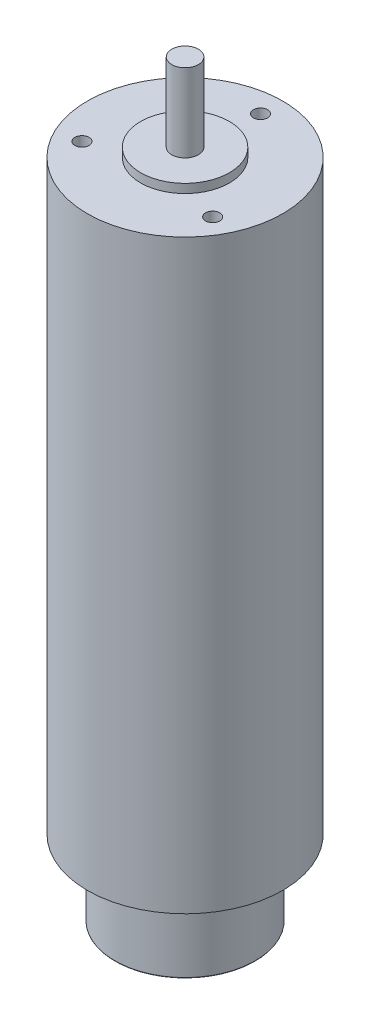
from build123d import *

# Parameters (mm, degrees)
SKETCH_1_R               = 11
EXTRUDE_1_DEPTH          = 66
SKETCH_2_R               = 5
EXTRUDE_2_DEPTH          = 1
SKETCH_3_R               = 1.5
EXTRUDE_3_DEPTH          = 8.8
SKETCH_4_R               = 7.9
EXTRUDE_4_DEPTH          = 8.5
FILLET_2_R               = 0.1
PATTERN_CIRCULAR_2_COUNT = 3


with BuildPart() as part:
    # 스케치1 → 보스-돌출1 (new body)
    with BuildSketch(Plane(origin=(0, 0, 0), x_dir=(1, 0, 0), z_dir=(0, 1, 0))):
        with Locations(Location((0, 0, 0), (0, 0, 270))):
            Circle(SKETCH_1_R)
    extrude(amount=EXTRUDE_1_DEPTH)

    # 스케치8 → M2 나사 구멍1 (revolve, cut)
    with BuildSketch(Plane(origin=(0, 66, -8.5), x_dir=(0, 0, 1), z_dir=(1, 0, 0))):
        Polygon((0, 0), (0, 5.480688495), (0.8, 5), (0.8, 0), align=None)
    hole_wizard_m2_1 = revolve(axis=Axis((0, 72.35, -8.5), (0, -1, 0)), mode=Mode.SUBTRACT)

    # 원형 패턴2: M2 나사 구멍1 ×3 about axis
    pattern_circular_2_axis = Axis((0, 0, 0), (0, 1, 0))
    for i in range(1, PATTERN_CIRCULAR_2_COUNT):
        add(hole_wizard_m2_1.rotate(pattern_circular_2_axis, i * 360 / PATTERN_CIRCULAR_2_COUNT), mode=Mode.SUBTRACT)


with BuildPart() as body_2:
    # 스케치2 → 보스-돌출2 (new body)
    with BuildSketch(Plane(origin=(0, 66, 0), x_dir=(1, 0, 0), z_dir=(0, 1, 0))):
        with Locations(Location((0, 0, 0), (0, 0, 270))):
            Circle(SKETCH_2_R)
    extrude(amount=EXTRUDE_2_DEPTH)


with BuildPart() as body_3:
    # 스케치3 → 보스-돌출3 (new body)
    with BuildSketch(Plane(origin=(0, 67, 0), x_dir=(1, 0, 0), z_dir=(0, 1, 0))):
        with Locations(Location((0, 0, 0), (0, 0, 270))):
            Circle(SKETCH_3_R)
    extrude(amount=EXTRUDE_3_DEPTH)


with BuildPart() as body_4:
    # 스케치4 → 보스-돌출4 (new body)
    with BuildSketch(Plane.XZ):
        with Locations(Location((0, 0, 0), (0, 0, 270))):
            Circle(SKETCH_4_R)
    extrude(amount=EXTRUDE_4_DEPTH)

    # 필렛2
    fillet_2_edges = [body_4.edges().sort_by_distance(p)[0] for p in [
        (0, -8.5, 7.9),
    ]]
    fillet(fillet_2_edges, radius=FILLET_2_R)


solid = Compound([part.part, body_2.part, body_3.part, body_4.part])
